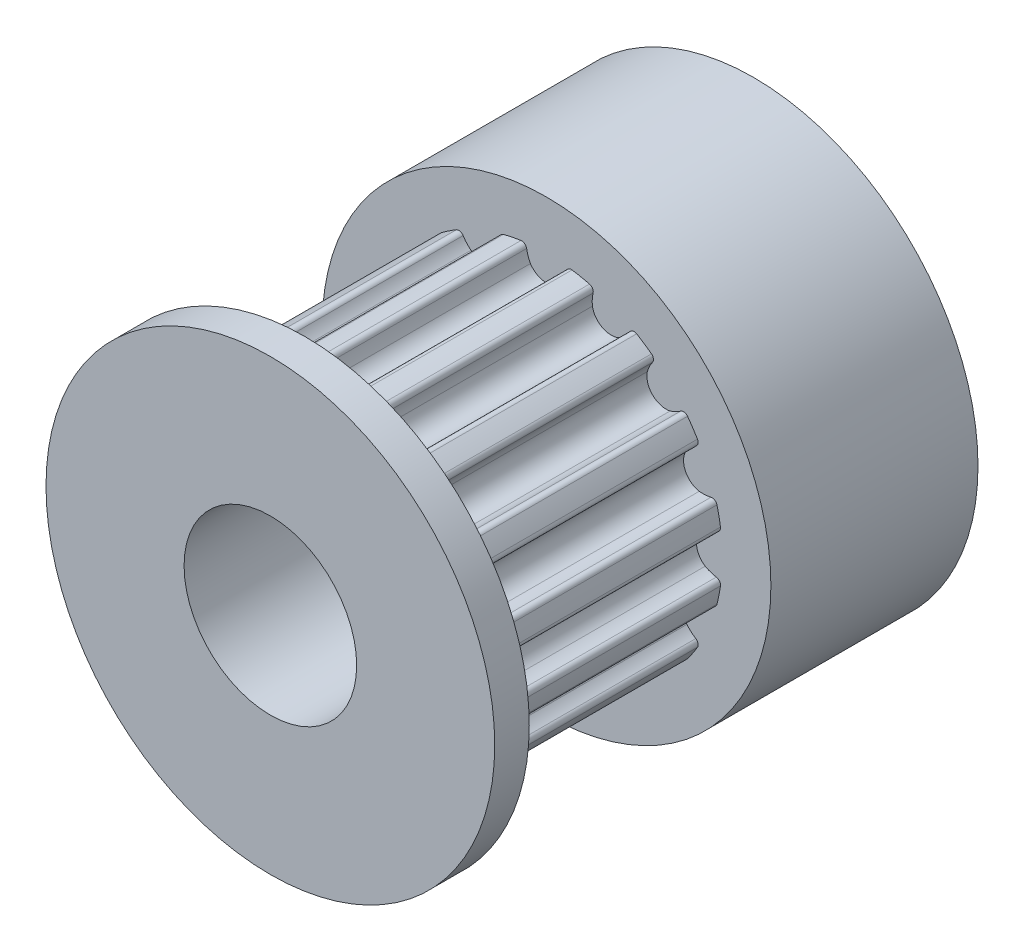
from build123d import *

# Parameters (mm, degrees)
SKETCH1_R           = 6.5
SKETCH1_R_2         = 2.5
BOSS_EXTRUDE1_DEPTH = 14
CUT_EXTRUDE1_START  = -7
SKETCH2_R           = 6.5
CUT_EXTRUDE1_DEPTH  = 7


with BuildPart() as part:
    # Sketch1 → Boss-Extrude1 (new body)
    with BuildSketch(Plane.XY):
        Circle(SKETCH1_R)
        Circle(SKETCH1_R_2, mode=Mode.SUBTRACT)
    extrude(amount=BOSS_EXTRUDE1_DEPTH)

    # Sketch2 → Cut-Extrude1 (cut)
    with BuildSketch(Plane(origin=(0, 0, 6), x_dir=(-1, 0, 0), z_dir=(0, 0, -1)).offset(CUT_EXTRUDE1_START)):
        Circle(SKETCH2_R)
        with BuildLine():
            ThreePointArc((0.465921662, 4.596392257), (0, 4.342958179), (-0.465921662, 4.596392257))
            ThreePointArc((-0.465921662, 4.596392257), (-0.534958832, 4.753164993), (-0.576226551, 4.91942021))
            ThreePointArc((-0.576226551, 4.91942021), (-0.633045999, 5.012666816), (-0.739003198, 5.039057182))
            ThreePointArc((-0.739003198, 5.039057182), (-0.866573807, 5.018692345), (-0.993586851, 4.995098416))
            ThreePointArc((-0.993586851, 4.995098416), (-1.119960609, 4.968290576), (-1.24561377, 4.938286074))
            ThreePointArc((-1.24561377, 4.938286074), (-1.3334063, 4.87335649), (-1.350216695, 4.765463998))
            ThreePointArc((-1.350216695, 4.765463998), (-1.324719979, 4.596071734), (-1.328507678, 4.424813231))
            ThreePointArc((-1.328507678, 4.424813231), (-1.661978143, 4.012370172), (-2.189418652, 4.068212229))
            ThreePointArc((-2.189418652, 4.068212229), (-2.31319501, 4.18663197), (-2.414944528, 4.324439289))
            ThreePointArc((-2.414944528, 4.324439289), (-2.503122784, 4.388844059), (-2.611113627, 4.372677514))
            ThreePointArc((-2.611113627, 4.372677514), (-2.721180216, 4.305043698), (-2.829495962, 4.234639963))
            ThreePointArc((-2.829495962, 4.234639963), (-2.935991174, 4.161511605), (-3.040597332, 4.085705677))
            ThreePointArc((-3.040597332, 4.085705677), (-3.096859578, 3.992121816), (-3.071101688, 3.886009091))
            ThreePointArc((-3.071101688, 3.886009091), (-2.982722181, 3.739268217), (-2.920683768, 3.579596501))
            ThreePointArc((-2.920683768, 3.579596501), (-3.070935179, 3.070935179), (-3.579596501, 2.920683768))
            ThreePointArc((-3.579596501, 2.920683768), (-3.739268217, 2.982722181), (-3.886009091, 3.071101688))
            ThreePointArc((-3.886009091, 3.071101688), (-3.992121816, 3.096859578), (-4.085705677, 3.040597332))
            ThreePointArc((-4.085705677, 3.040597332), (-4.161511605, 2.935991174), (-4.234639963, 2.829495962))
            ThreePointArc((-4.234639963, 2.829495962), (-4.305043698, 2.721180216), (-4.372677514, 2.611113627))
            ThreePointArc((-4.372677514, 2.611113627), (-4.388844059, 2.503122784), (-4.324439289, 2.414944528))
            ThreePointArc((-4.324439289, 2.414944528), (-4.18663197, 2.31319501), (-4.068212229, 2.189418652))
            ThreePointArc((-4.068212229, 2.189418652), (-4.012370172, 1.661978143), (-4.424813231, 1.328507678))
            ThreePointArc((-4.424813231, 1.328507678), (-4.596071734, 1.324719979), (-4.765463998, 1.350216695))
            ThreePointArc((-4.765463998, 1.350216695), (-4.87335649, 1.3334063), (-4.938286074, 1.24561377))
            ThreePointArc((-4.938286074, 1.24561377), (-4.968290576, 1.119960609), (-4.995098416, 0.993586851))
            ThreePointArc((-4.995098416, 0.993586851), (-5.018692345, 0.866573807), (-5.039057182, 0.739003198))
            ThreePointArc((-5.039057182, 0.739003198), (-5.012666816, 0.633045999), (-4.91942021, 0.576226551))
            ThreePointArc((-4.91942021, 0.576226551), (-4.753164993, 0.534958832), (-4.596392257, 0.465921662))
            ThreePointArc((-4.596392257, 0.465921662), (-4.342958179, 0), (-4.596392257, -0.465921662))
            ThreePointArc((-4.596392257, -0.465921662), (-4.753164993, -0.534958832), (-4.91942021, -0.576226551))
            ThreePointArc((-4.91942021, -0.576226551), (-5.012666816, -0.633045999), (-5.039057182, -0.739003198))
            ThreePointArc((-5.039057182, -0.739003198), (-5.018692345, -0.866573807), (-4.995098416, -0.993586851))
            ThreePointArc((-4.995098416, -0.993586851), (-4.968290576, -1.119960609), (-4.938286074, -1.24561377))
            ThreePointArc((-4.938286074, -1.24561377), (-4.87335649, -1.3334063), (-4.765463998, -1.350216695))
            ThreePointArc((-4.765463998, -1.350216695), (-4.596071734, -1.324719979), (-4.424813231, -1.328507678))
            ThreePointArc((-4.424813231, -1.328507678), (-4.012370172, -1.661978143), (-4.068212229, -2.189418652))
            ThreePointArc((-4.068212229, -2.189418652), (-4.18663197, -2.31319501), (-4.324439289, -2.414944528))
            ThreePointArc((-4.324439289, -2.414944528), (-4.388844059, -2.503122784), (-4.372677514, -2.611113627))
            ThreePointArc((-4.372677514, -2.611113627), (-4.305043698, -2.721180216), (-4.234639963, -2.829495962))
            ThreePointArc((-4.234639963, -2.829495962), (-4.161511605, -2.935991174), (-4.085705677, -3.040597332))
            ThreePointArc((-4.085705677, -3.040597332), (-3.992121816, -3.096859578), (-3.886009091, -3.071101688))
            ThreePointArc((-3.886009091, -3.071101688), (-3.739268217, -2.982722181), (-3.579596501, -2.920683768))
            ThreePointArc((-3.579596501, -2.920683768), (-3.070935179, -3.070935179), (-2.920683768, -3.579596501))
            ThreePointArc((-2.920683768, -3.579596501), (-2.982722181, -3.739268217), (-3.071101688, -3.886009091))
            ThreePointArc((-3.071101688, -3.886009091), (-3.096859578, -3.992121816), (-3.040597332, -4.085705677))
            ThreePointArc((-3.040597332, -4.085705677), (-2.935991174, -4.161511605), (-2.829495962, -4.234639963))
            ThreePointArc((-2.829495962, -4.234639963), (-2.721180216, -4.305043698), (-2.611113627, -4.372677514))
            ThreePointArc((-2.611113627, -4.372677514), (-2.503122784, -4.388844059), (-2.414944528, -4.324439289))
            ThreePointArc((-2.414944528, -4.324439289), (-2.31319501, -4.18663197), (-2.189418652, -4.068212229))
            ThreePointArc((-2.189418652, -4.068212229), (-1.661978143, -4.012370172), (-1.328507678, -4.424813231))
            ThreePointArc((-1.328507678, -4.424813231), (-1.324719979, -4.596071734), (-1.350216695, -4.765463998))
            ThreePointArc((-1.350216695, -4.765463998), (-1.3334063, -4.87335649), (-1.24561377, -4.938286074))
            ThreePointArc((-1.24561377, -4.938286074), (-1.119960609, -4.968290576), (-0.993586851, -4.995098416))
            ThreePointArc((-0.993586851, -4.995098416), (-0.866573807, -5.018692345), (-0.739003198, -5.039057182))
            ThreePointArc((-0.739003198, -5.039057182), (-0.633045999, -5.012666816), (-0.576226551, -4.91942021))
            ThreePointArc((-0.576226551, -4.91942021), (-0.534958832, -4.753164993), (-0.465921662, -4.596392257))
            ThreePointArc((-0.465921662, -4.596392257), (0, -4.342958179), (0.465921662, -4.596392257))
            ThreePointArc((0.465921662, -4.596392257), (0.534958832, -4.753164993), (0.576226551, -4.91942021))
            ThreePointArc((0.576226551, -4.91942021), (0.633045999, -5.012666816), (0.739003198, -5.039057182))
            ThreePointArc((0.739003198, -5.039057182), (0.866573807, -5.018692345), (0.993586851, -4.995098416))
            ThreePointArc((0.993586851, -4.995098416), (1.119960609, -4.968290576), (1.24561377, -4.938286074))
            ThreePointArc((1.24561377, -4.938286074), (1.3334063, -4.87335649), (1.350216695, -4.765463998))
            ThreePointArc((1.350216695, -4.765463998), (1.324719979, -4.596071734), (1.328507678, -4.424813231))
            ThreePointArc((1.328507678, -4.424813231), (1.661978143, -4.012370172), (2.189418652, -4.068212229))
            ThreePointArc((2.189418652, -4.068212229), (2.31319501, -4.18663197), (2.414944528, -4.324439289))
            ThreePointArc((2.414944528, -4.324439289), (2.503122784, -4.388844059), (2.611113627, -4.372677514))
            ThreePointArc((2.611113627, -4.372677514), (2.721180216, -4.305043698), (2.829495962, -4.234639963))
            ThreePointArc((2.829495962, -4.234639963), (2.935991174, -4.161511605), (3.040597332, -4.085705677))
            ThreePointArc((3.040597332, -4.085705677), (3.096859578, -3.992121816), (3.071101688, -3.886009091))
            ThreePointArc((3.071101688, -3.886009091), (2.982722181, -3.739268217), (2.920683768, -3.579596501))
            ThreePointArc((2.920683768, -3.579596501), (3.070935179, -3.070935179), (3.579596501, -2.920683768))
            ThreePointArc((3.579596501, -2.920683768), (3.739268217, -2.982722181), (3.886009091, -3.071101688))
            ThreePointArc((3.886009091, -3.071101688), (3.992121816, -3.096859578), (4.085705677, -3.040597332))
            ThreePointArc((4.085705677, -3.040597332), (4.161511605, -2.935991174), (4.234639963, -2.829495962))
            ThreePointArc((4.234639963, -2.829495962), (4.305043698, -2.721180216), (4.372677514, -2.611113627))
            ThreePointArc((4.372677514, -2.611113627), (4.388844059, -2.503122784), (4.324439289, -2.414944528))
            ThreePointArc((4.324439289, -2.414944528), (4.18663197, -2.31319501), (4.068212229, -2.189418652))
            ThreePointArc((4.068212229, -2.189418652), (4.012370172, -1.661978143), (4.424813231, -1.328507678))
            ThreePointArc((4.424813231, -1.328507678), (4.596071734, -1.324719979), (4.765463998, -1.350216695))
            ThreePointArc((4.765463998, -1.350216695), (4.87335649, -1.3334063), (4.938286074, -1.24561377))
            ThreePointArc((4.938286074, -1.24561377), (4.968290576, -1.119960609), (4.995098416, -0.993586851))
            ThreePointArc((4.995098416, -0.993586851), (5.018692345, -0.866573807), (5.039057182, -0.739003198))
            ThreePointArc((5.039057182, -0.739003198), (5.012666816, -0.633045999), (4.91942021, -0.576226551))
            ThreePointArc((4.91942021, -0.576226551), (4.753164993, -0.534958832), (4.596392257, -0.465921662))
            ThreePointArc((4.596392257, -0.465921662), (4.342958179, 0), (4.596392257, 0.465921662))
            ThreePointArc((4.596392257, 0.465921662), (4.753164993, 0.534958832), (4.91942021, 0.576226551))
            ThreePointArc((4.91942021, 0.576226551), (5.012666816, 0.633045999), (5.039057182, 0.739003198))
            ThreePointArc((5.039057182, 0.739003198), (5.018692345, 0.866573807), (4.995098416, 0.993586851))
            ThreePointArc((4.995098416, 0.993586851), (4.968290576, 1.119960609), (4.938286074, 1.24561377))
            ThreePointArc((4.938286074, 1.24561377), (4.87335649, 1.3334063), (4.765463998, 1.350216695))
            ThreePointArc((4.765463998, 1.350216695), (4.596071734, 1.324719979), (4.424813231, 1.328507678))
            ThreePointArc((4.424813231, 1.328507678), (4.012370172, 1.661978143), (4.068212229, 2.189418652))
            ThreePointArc((4.068212229, 2.189418652), (4.18663197, 2.31319501), (4.324439289, 2.414944528))
            ThreePointArc((4.324439289, 2.414944528), (4.388844059, 2.503122784), (4.372677514, 2.611113627))
            ThreePointArc((4.372677514, 2.611113627), (4.305043698, 2.721180216), (4.234639963, 2.829495962))
            ThreePointArc((4.234639963, 2.829495962), (4.161511605, 2.935991174), (4.085705677, 3.040597332))
            ThreePointArc((4.085705677, 3.040597332), (3.992121816, 3.096859578), (3.886009091, 3.071101688))
            ThreePointArc((3.886009091, 3.071101688), (3.739268217, 2.982722181), (3.579596501, 2.920683768))
            ThreePointArc((3.579596501, 2.920683768), (3.070935179, 3.070935179), (2.920683768, 3.579596501))
            ThreePointArc((2.920683768, 3.579596501), (2.982722181, 3.739268217), (3.071101688, 3.886009091))
            ThreePointArc((3.071101688, 3.886009091), (3.096859578, 3.992121816), (3.040597332, 4.085705677))
            ThreePointArc((3.040597332, 4.085705677), (2.935991174, 4.161511605), (2.829495962, 4.234639963))
            ThreePointArc((2.829495962, 4.234639963), (2.721180216, 4.305043698), (2.611113627, 4.372677514))
            ThreePointArc((2.611113627, 4.372677514), (2.503122784, 4.388844059), (2.414944528, 4.324439289))
            ThreePointArc((2.414944528, 4.324439289), (2.31319501, 4.18663197), (2.189418652, 4.068212229))
            ThreePointArc((2.189418652, 4.068212229), (1.661978143, 4.012370172), (1.328507678, 4.424813231))
            ThreePointArc((1.328507678, 4.424813231), (1.324719979, 4.596071734), (1.350216695, 4.765463998))
            ThreePointArc((1.350216695, 4.765463998), (1.3334063, 4.87335649), (1.24561377, 4.938286074))
            ThreePointArc((1.24561377, 4.938286074), (1.119960609, 4.968290576), (0.993586851, 4.995098416))
            ThreePointArc((0.993586851, 4.995098416), (0.866573807, 5.018692345), (0.739003198, 5.039057182))
            ThreePointArc((0.739003198, 5.039057182), (0.633045999, 5.012666816), (0.576226551, 4.91942021))
            ThreePointArc((0.576226551, 4.91942021), (0.534958832, 4.753164993), (0.465921662, 4.596392257))
        make_face(mode=Mode.SUBTRACT)
    extrude(amount=CUT_EXTRUDE1_DEPTH, mode=Mode.SUBTRACT)


solid = part.part
